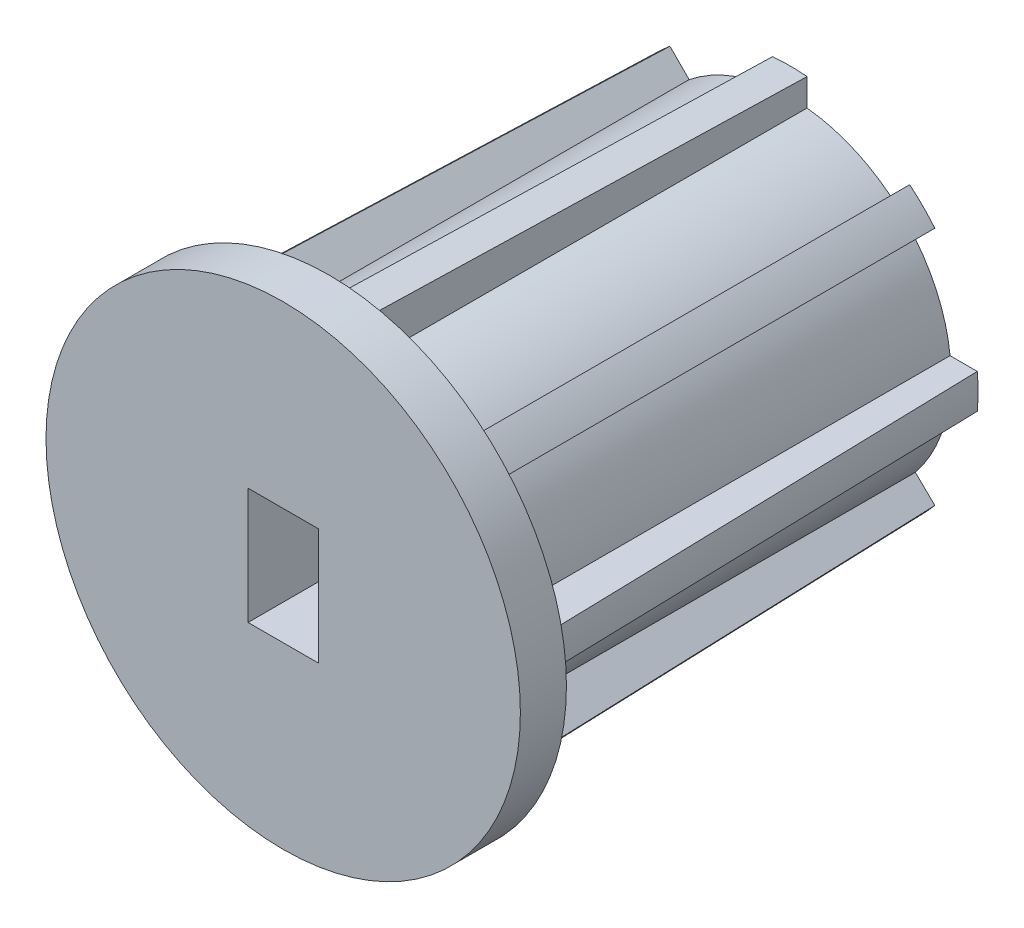
from build123d import *

# Parameters (mm, degrees)
SKETCH_1_R           = 20.6
EXTRUDE_1_DEPTH      = 4
EXTRUDE_2_DEPTH      = 1
EXTRUDE_2_DEPTH_BACK = 40
SKETCH_2_R           = 14
SKETCH_2_R_2         = 10
EXTRUDE_3_DEPTH      = 40
SKETCH_9_R           = 14
EXTRUDE_4_DEPTH      = 14
SKETCH_10_W          = 6.1
SKETCH_10_H          = 10.1
CUT_EXTRUDE_1_DEPTH  = 12
SCALE_1_SCALE        = 0.5


with BuildPart() as part:
    # Эскиз1 → Бобышка-Вытянуть1 (new body)
    with BuildSketch(Plane.XY):
        Circle(SKETCH_1_R)
    extrude(amount=EXTRUDE_1_DEPTH)



with BuildPart() as body_2:
    # Эскиз2 → Бобышка-Вытянуть2 (new, two sides: drawn at the far end of the back side and taken through both)
    with BuildSketch(Plane.XY.offset(-EXTRUDE_2_DEPTH_BACK)):
        Circle(SKETCH_2_R)
        Circle(SKETCH_2_R_2, mode=Mode.SUBTRACT)
    extrude(amount=EXTRUDE_2_DEPTH + EXTRUDE_2_DEPTH_BACK)


with BuildPart() as part_1:
    add(part.part)

    add(body_2.part)  # Бобышка-Вытянуть3 merges body 2
    # Эскиз3 → Бобышка-Вытянуть3 (add)
    with BuildSketch(Plane(origin=(0, 0, 0), x_dir=(-1, 0, 0), z_dir=(0, 0, -1))):
        with BuildLine():
            Line((-13.919410907, 1.5), (-17.335224256, 1.5))
            ThreePointArc((-17.335224256, 1.5), (-17.4, 0), (-17.335224256, -1.5))
            Line((-17.335224256, -1.5), (-13.919410907, -1.5))
            ThreePointArc((-13.919410907, -1.5), (-14, 0), (-13.919410907, 1.5))
        make_face()
        with BuildLine():
            Line((-13.352061647, 11.15717033), (-10.90373204, 8.781151838))
            ThreePointArc((-10.90373204, 8.781151838), (-9.880739986, 9.918214422), (-8.73981303, 10.936894815))
            Line((-8.73981303, 10.936894815), (-11.155976965, 13.353058749))
            ThreePointArc((-11.155976965, 13.353058749), (-12.30310817, 12.304207791), (-13.352061647, 11.15717033))
        make_face()
        with BuildLine():
            ThreePointArc((-8.73981303, -10.936894815), (-9.880739986, -9.918214422), (-10.90373204, -8.781151838))
            Line((-10.90373204, -8.781151838), (-13.352061647, -11.15717033))
            ThreePointArc((-13.352061647, -11.15717033), (-12.30310817, -12.304207791), (-11.155976965, -13.353058749))
            Line((-11.155976965, -13.353058749), (-8.73981303, -10.936894815))
        make_face()
        with BuildLine():
            Line((-1.5, 17.335224256), (-1.5, 13.919410907))
            ThreePointArc((-1.5, 13.919410907), (0, 14), (1.5, 13.919410907))
            Line((1.5, 13.919410907), (1.5, 17.335224256))
            ThreePointArc((1.5, 17.335224256), (0, 17.4), (-1.5, 17.335224256))
        make_face()
        with BuildLine():
            ThreePointArc((1.5, -13.919410907), (0, -14), (-1.5, -13.919410907))
            Line((-1.5, -13.919410907), (-1.5, -17.335224256))
            ThreePointArc((-1.5, -17.335224256), (0, -17.4), (1.5, -17.335224256))
            Line((1.5, -17.335224256), (1.5, -13.919410907))
        make_face()
        with BuildLine():
            Line((11.155976965, 13.353058749), (8.73981303, 10.936894815))
            ThreePointArc((8.73981303, 10.936894815), (9.880739986, 9.918214422), (10.90373204, 8.781151838))
            Line((10.90373204, 8.781151838), (13.352061647, 11.15717033))
            ThreePointArc((13.352061647, 11.15717033), (12.30310817, 12.304207791), (11.155976965, 13.353058749))
        make_face()
        with BuildLine():
            ThreePointArc((10.90373204, -8.781151838), (9.880739986, -9.918214422), (8.73981303, -10.936894815))
            Line((8.73981303, -10.936894815), (11.155976965, -13.353058749))
            ThreePointArc((11.155976965, -13.353058749), (12.30310817, -12.304207791), (13.352061647, -11.15717033))
            Line((13.352061647, -11.15717033), (10.90373204, -8.781151838))
        make_face()
        with BuildLine():
            Line((17.335224256, 1.5), (13.919410907, 1.5))
            ThreePointArc((13.919410907, 1.5), (14, 0), (13.919410907, -1.5))
            Line((13.919410907, -1.5), (17.335224256, -1.5))
            ThreePointArc((17.335224256, -1.5), (17.4, 0), (17.335224256, 1.5))
        make_face()
    extrude(amount=EXTRUDE_3_DEPTH)

    # Эскиз8 → Вырез-Повернуть2 (revolve, cut)
    with BuildSketch(Plane(origin=(0, 0, 0), x_dir=(0, 0, -1), z_dir=(1, 0, 0))):
        Polygon((40, 16.352563137), (0, 17.4), (40, 17.4), align=None)
    revolve(axis=Axis((0, 0, 0), (0, 0, -1)), mode=Mode.SUBTRACT)

    # Эскиз9 → Бобышка-Вытянуть4 (add)
    with BuildSketch(Plane(origin=(0, 0, 0), x_dir=(-1, 0, 0), z_dir=(0, 0, -1))):
        Circle(SKETCH_9_R)
    extrude(amount=EXTRUDE_4_DEPTH)

    # Эскиз10 → Вырез-Вытянуть1 (cut)
    with BuildSketch(Plane.XY.offset(4)):
        Rectangle(SKETCH_10_W, SKETCH_10_H)
    extrude(amount=-CUT_EXTRUDE_1_DEPTH, mode=Mode.SUBTRACT)


with BuildPart() as part_2:
    # Масштаб1: scaled about (0, 0, -13.100376841)
    add(part_1.part.scale(SCALE_1_SCALE).moved(Location((0, 0, -6.55018842))))


solid = part_2.part
